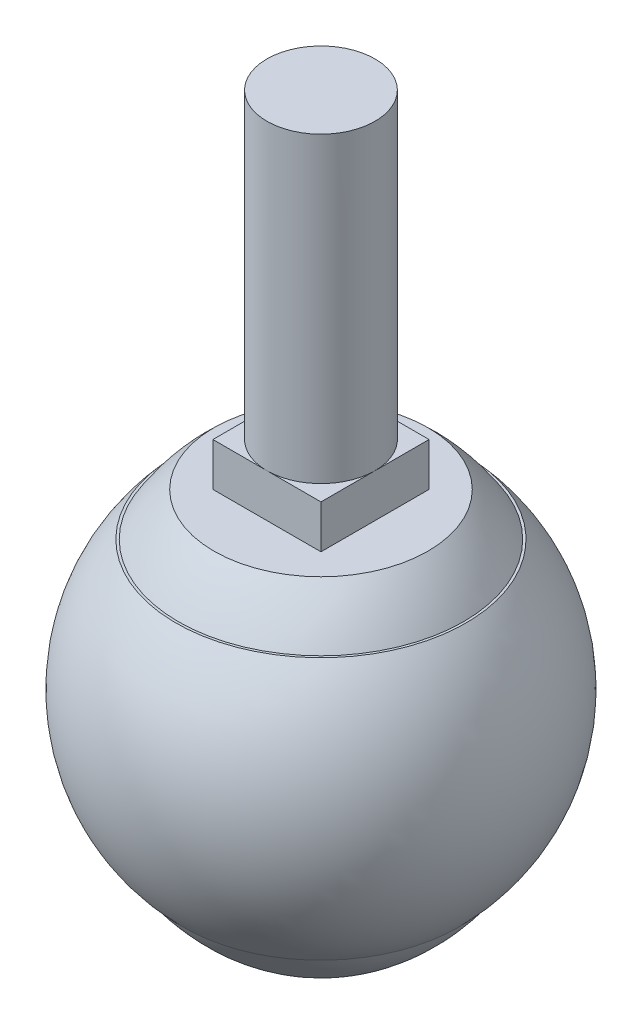
from build123d import *

# Parameters (mm, degrees)
SKETCH2_W           = 5
SKETCH2_H           = 5
BOSS_EXTRUDE1_DEPTH = 2
SKETCH3_R           = 2.5
BOSS_EXTRUDE2_DEPTH = 14


with BuildPart() as part:
    # Sketch1 → Revolve1 (revolve)
    with BuildSketch(Plane.XY):
        with BuildLine():
            Line((0, 8), (4.95, 8))
            add(Edge.make_bspline(
                [(0, -10), (24.75, -10), (4.95, 8)],
                knots=[3.141592654, 3.141592654, 3.141592654, 5.639684198, 5.639684198, 5.639684198], degree=2, weights=[1, 0.316227766, 1]))
            Line((0, -10), (0, 8))
        make_face()
    revolve(axis=Axis((0, 8, 0), (0, -1, 0)))

    # Sketch2 → Boss-Extrude1 (add)
    with BuildSketch(Plane(origin=(0, 8, 0), x_dir=(1, 0, 0), z_dir=(0, 1, 0))):
        Rectangle(SKETCH2_W, SKETCH2_H)
    extrude(amount=BOSS_EXTRUDE1_DEPTH)

    # Sketch3 → Boss-Extrude2 (add)
    with BuildSketch(Plane(origin=(0, 10, 0), x_dir=(1, 0, 0), z_dir=(0, 1, 0))):
        with Locations(Location((0, 0, 0), (0, 0, 180))):
            Circle(SKETCH3_R)
    extrude(amount=BOSS_EXTRUDE2_DEPTH)

    # Sketch4 → Revolve3 (revolve)
    with BuildSketch(Plane.XY, mode=Mode.PRIVATE) as revolve3_sk:
        with BuildLine():
            Line((-0.001464112, 6), (6.708203932, 6))
            ThreePointArc((6.708203932, 6), (8.215539475, -3.674902875), (-0.001464112, -8.999999881))
            Line((-0.001464112, -8.999999881), (-0.001464112, 6))
        make_face()
    revolve(revolve3_sk.sketch.rotate(Axis((-0.001464112, 6, 0), (0, -1, 0)), 180), axis=Axis((-0.001464112, 6, 0), (0, -1, 0)))


solid = part.part
